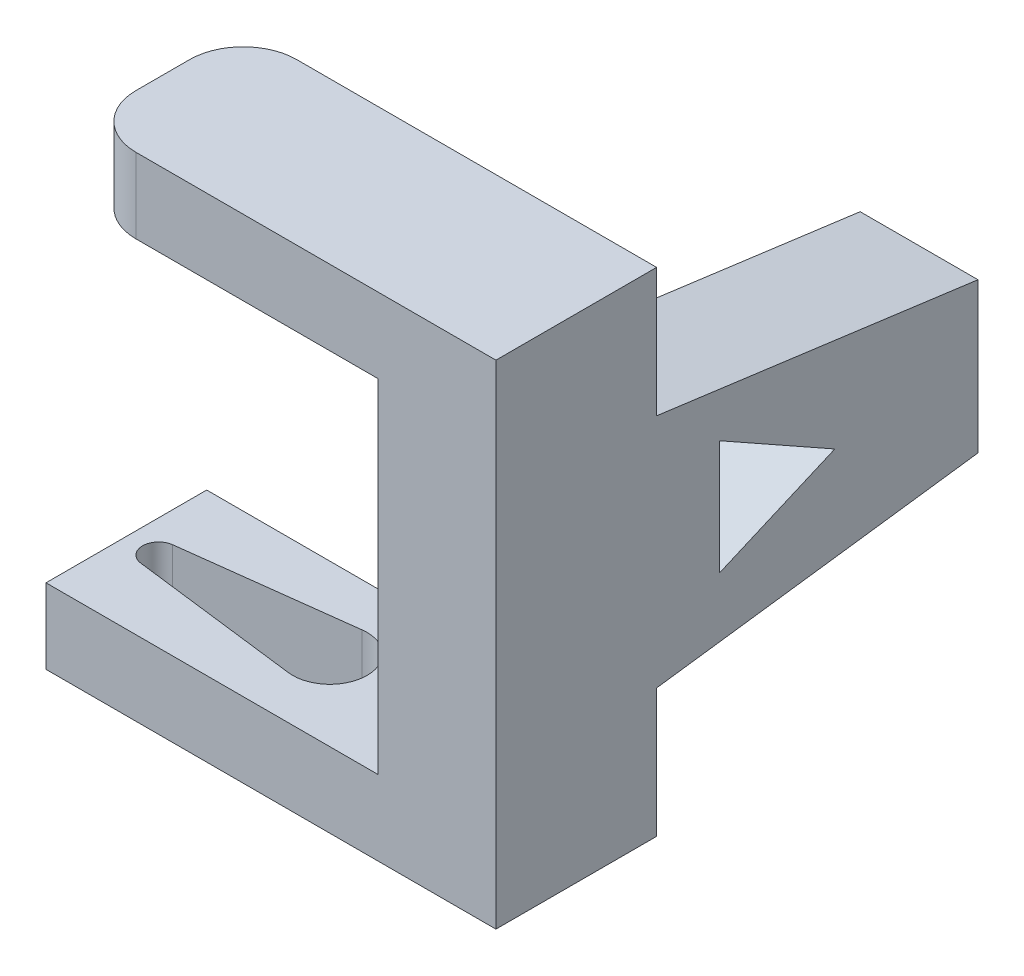
from build123d import *

# Parameters (mm, degrees)
EXTRUDE_1_DEPTH     = 15
SKETCH_3_W          = 15
SKETCH_3_H          = 3
EXTRUDE_2_DEPTH     = 15
CUT_EXTRUDE_1_DEPTH = 15
SKETCH_5_W          = 15
SKETCH_5_H          = 38
EXTRUDE_3_DEPTH     = 10
SKETCH_6_W          = 8
SKETCH_6_H          = 32
CUT_EXTRUDE_2_DEPTH = 22
SKETCH_7_W          = 7
SKETCH_7_H          = 22
EXTRUDE_4_DEPTH     = 30
CUT_EXTRUDE_3_DEPTH = 30
CUT_EXTRUDE_4_DEPTH = 30
SKETCH_10_W         = 3.405660377
SKETCH_10_H         = 15
CUT_EXTRUDE_5_DEPTH = 10
CUT_EXTRUDE_6_DEPTH = 10
SKETCH_12_W         = 38
SKETCH_12_H         = 15
EXTRUDE_5_DEPTH     = 4
EXTRUDE_START       = 4
SKETCH_13_W         = 29.594339623
SKETCH_13_H         = 15
EXTRUDE_6_DEPTH     = 4
SKETCH_14_W         = 15
SKETCH_14_H         = 46
EXTRUDE_7_DEPTH     = 4
EXTRUDE_9_DEPTH     = 4


with BuildPart() as part:
    # 草图1 → 凸台-拉伸1 (new body)
    with BuildSketch(Plane.XY):
        Polygon((13, 0), (0, 0), (0, -3), (8, -3), (8, -35), (0, -35), (0, -38), (13, -38), align=None)
    extrude(amount=EXTRUDE_1_DEPTH)

    # 草图3 → 凸台-拉伸2 (add)
    with BuildSketch(Plane.ZY):
        with Locations((7.5, -1.5)):
            Rectangle(SKETCH_3_W, SKETCH_3_H)
        with Locations((7.5, -36.5)):
            Rectangle(SKETCH_3_W, SKETCH_3_H)
    extrude(amount=EXTRUDE_2_DEPTH)

    # 草图4 → 切除-拉伸1 (cut)
    with BuildSketch(Plane.XZ.offset(38)):
        with BuildLine():
            Line((-12.170329997, 8.9885069), (3.570652174, 10.948374319))
            ThreePointArc((3.570652174, 10.948374319), (7.475, 7.5), (3.570652174, 4.051625681))
            Line((3.570652174, 4.051625681), (-12.170329997, 6.0114931))
            ThreePointArc((-12.170329997, 6.0114931), (-13.485, 7.5), (-12.170329997, 8.9885069))
        make_face()
    extrude(amount=-CUT_EXTRUDE_1_DEPTH, mode=Mode.SUBTRACT)

    # 草图5 → 凸台-拉伸3 (add)
    with BuildSketch(Plane(origin=(13, 0, 0), x_dir=(0, 0, -1), z_dir=(1, 0, 0))):
        with Locations((-7.5, -19)):
            Rectangle(SKETCH_5_W, SKETCH_5_H)
    extrude(amount=EXTRUDE_3_DEPTH)

    # 草图6 → 切除-拉伸2 (cut)
    with BuildSketch(Plane.XY.offset(15)):
        with Locations((12, -19)):
            Rectangle(SKETCH_6_W, SKETCH_6_H)
    extrude(amount=-CUT_EXTRUDE_2_DEPTH, mode=Mode.SUBTRACT)

    # 草图7 → 凸台-拉伸4 (add)
    with BuildSketch(Plane(origin=(0, 0, 0), x_dir=(-1, 0, 0), z_dir=(0, 0, -1))):
        with Locations((-19.5, -19)):
            Rectangle(SKETCH_7_W, SKETCH_7_H)
    extrude(amount=EXTRUDE_4_DEPTH)

    # 草图8 → 切除-拉伸3 (cut)
    with BuildSketch(Plane(origin=(23, 0, 0), x_dir=(0, 0, -1), z_dir=(1, 0, 0))):
        Polygon((0, -8), (30, -12), (30, -8), align=None)
        Polygon((0, -30), (30, -30), (30, -26), align=None)
    extrude(amount=-CUT_EXTRUDE_3_DEPTH, mode=Mode.SUBTRACT)

    # 草图9 → 切除-拉伸4 (cut)
    with BuildSketch(Plane(origin=(23, 0, 0), x_dir=(0, 0, -1), z_dir=(1, 0, 0))):
        Polygon((5.866710017, -12.950612604), (5.866710017, -19), (5.866710017, -23.641237949), (16.631575815, -19), align=None)
    extrude(amount=-CUT_EXTRUDE_4_DEPTH, mode=Mode.SUBTRACT)

    # 草图10 → 切除-拉伸5 (cut)
    with BuildSketch(Plane(origin=(0, 0, 0), x_dir=(1, 0, 0), z_dir=(0, 1, 0))):
        with Locations((-13.297169812, -7.5)):
            Rectangle(SKETCH_10_W, SKETCH_10_H)
    extrude(amount=-CUT_EXTRUDE_5_DEPTH, mode=Mode.SUBTRACT)

    # 草图11 → 切除-拉伸6 (cut)
    with BuildSketch(Plane(origin=(0, 0, 0), x_dir=(1, 0, 0), z_dir=(0, 1, 0))):
        with BuildLine():
            ThreePointArc((-6.594339623, -15), (-10.129873529, -13.535533906), (-11.594339623, -10))
            Line((-11.594339623, -10), (-11.594339623, -15))
            Line((-11.594339623, -15), (-6.594339623, -15))
        make_face()
        with BuildLine():
            Line((-11.594339623, 0), (-11.594339623, -5))
            ThreePointArc((-11.594339623, -5), (-10.129873529, -1.464466094), (-6.594339623, 0))
            Line((-6.594339623, 0), (-11.594339623, 0))
        make_face()
    extrude(amount=-CUT_EXTRUDE_6_DEPTH, mode=Mode.SUBTRACT)

    # 草图13 → 凸台-拉伸6 (add)
    with BuildSketch(Plane(origin=(0, 0, 0), x_dir=(1, 0, 0), z_dir=(0, 1, 0)).offset(EXTRUDE_START)):
        with BuildLine():
            Line((-6.594339623, 0), (-6.594339623, -15))
            ThreePointArc((-6.594339623, -15), (-10.129873529, -13.535533906), (-11.594339623, -10))
            Line((-11.594339623, -10), (-11.594339623, -5))
            ThreePointArc((-11.594339623, -5), (-10.129873529, -1.464466094), (-6.594339623, 0))
        make_face()
        with Locations((8.202830189, -7.5)):
            Rectangle(SKETCH_13_W, SKETCH_13_H)
    extrude(amount=-EXTRUDE_6_DEPTH)



with BuildPart() as body_2:
    # 草图12 → 凸台-拉伸5 (new body)
    with BuildSketch(Plane(origin=(0, -38, 0), x_dir=(-1, 0, 0), z_dir=(0, -1, 0))):
        with Locations((-4, -7.5)):
            Rectangle(SKETCH_12_W, SKETCH_12_H)
        with BuildLine():
            ThreePointArc((-3.570652174, -10.948374319), (-7.475, -7.5), (-3.570652174, -4.051625681))
            Line((-3.570652174, -4.051625681), (12.170329997, -6.0114931))
            ThreePointArc((12.170329997, -6.0114931), (13.485, -7.5), (12.170329997, -8.9885069))
            Line((12.170329997, -8.9885069), (-3.570652174, -10.948374319))
        make_face(mode=Mode.SUBTRACT)
    extrude(amount=EXTRUDE_5_DEPTH)


with BuildPart() as part_1:
    add(part.part)

    add(body_2.part)  # 凸台-拉伸7 merges body 2
    # 草图14 → 凸台-拉伸7 (add)
    with BuildSketch(Plane(origin=(23, 0, 0), x_dir=(0, 0, -1), z_dir=(1, 0, 0))):
        with Locations((-7.5, -19)):
            Rectangle(SKETCH_14_W, SKETCH_14_H)
    extrude(amount=EXTRUDE_7_DEPTH)

    # 草图15 → 凸台-拉伸9 (add)
    with BuildSketch(Plane(origin=(23, 0, 0), x_dir=(0, 0, -1), z_dir=(1, 0, 0))):
        Polygon((0, -8), (0, -30), (30, -26), (30, -12), align=None)
        Polygon((5.866710017, -12.950612604), (5.866710017, -23.641237949), (16.631575815, -19), align=None, mode=Mode.SUBTRACT)
    extrude(amount=EXTRUDE_9_DEPTH)


solid = part_1.part
